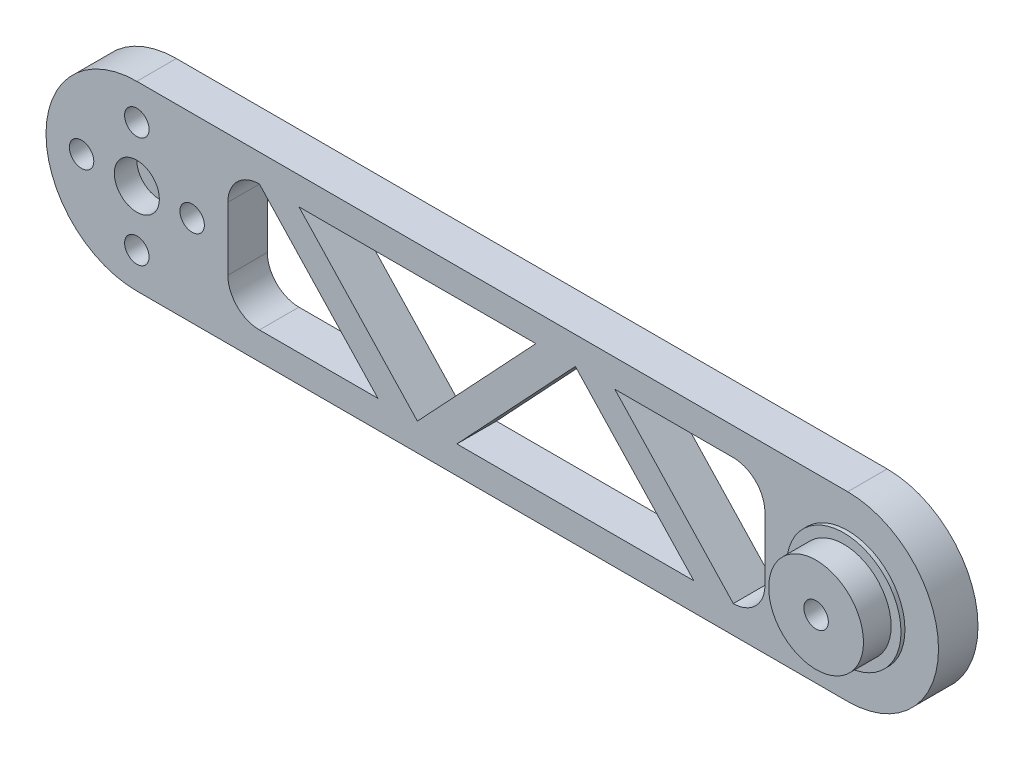
from build123d import *

# Parameters (mm, degrees)
BOSS_EXTRUDE1_DEPTH = 5
SKETCH11_R          = 7.25
BOSS_EXTRUDE3_DEPTH = 0.5
SKETCH12_R          = 6
BOSS_EXTRUDE4_DEPTH = 3.5
SKETCH13_R          = 1.55
CUT_EXTRUDE1_DEPTH  = 20.5
CUT_EXTRUDE2_DEPTH  = 2.6
SKETCH17_R          = 1.55
CUT_EXTRUDE4_DEPTH  = 10.02
SKETCH18_R          = 2.85
CUT_EXTRUDE5_DEPTH  = 2.85
CUT_EXTRUDE7_DEPTH  = 10


with BuildPart() as part:
    # Sketch2 → Boss-Extrude1 (new body)
    with BuildSketch(Plane.XY):
        with BuildLine():
            Line((0, 11.5), (90, 11.5))
            ThreePointArc((90, 11.5), (101.5, 0), (90, -11.5))
            Line((90, -11.5), (0, -11.5))
            ThreePointArc((0, -11.5), (-11.5, 0), (0, 11.5))
        make_face()
    extrude(amount=-BOSS_EXTRUDE1_DEPTH)

    # Sketch11 → Boss-Extrude3 (add)
    with BuildSketch(Plane.XY):
        with Locations((90, 0)):
            Circle(SKETCH11_R)
    extrude(amount=BOSS_EXTRUDE3_DEPTH)

    # Sketch12 → Boss-Extrude4 (add)
    with BuildSketch(Plane.XY.offset(0.5)):
        with Locations((90, 0)):
            Circle(SKETCH12_R)
    extrude(amount=BOSS_EXTRUDE4_DEPTH)

    # Sketch13 → Cut-Extrude1 (cut)
    with BuildSketch(Plane.XY.offset(4)):
        with Locations((90, 0)):
            Circle(SKETCH13_R)
    extrude(amount=-CUT_EXTRUDE1_DEPTH, mode=Mode.SUBTRACT)

    # Sketch14 → Cut-Extrude2 (cut)
    with BuildSketch(Plane(origin=(0, 0, -5), x_dir=(-1, 0, 0), z_dir=(0, 0, -1))):
        Polygon((-93.213605432, -0.355068252), (-91.299304589, -2.960598068), (-88.085699158, -2.605529815), (-86.786394568, 0.355068252), (-88.700695411, 2.960598068), (-91.914300842, 2.605529815), align=None)
    extrude(amount=-CUT_EXTRUDE2_DEPTH, mode=Mode.SUBTRACT)

    # Sketch17 → Cut-Extrude4 (cut)
    with BuildSketch(Plane.XY):
        with Locations((0, 7)):
            Circle(SKETCH17_R)
        with Locations((0, -7)):
            Circle(SKETCH17_R)
        with Locations((-7, 0)):
            Circle(SKETCH17_R)
        with Locations((7, 0)):
            Circle(SKETCH17_R)
    extrude(amount=-CUT_EXTRUDE4_DEPTH, mode=Mode.SUBTRACT)

    # Sketch18 → Cut-Extrude5 (cut)
    with BuildSketch(Plane.XY):
        Circle(SKETCH18_R)
    extrude(amount=-CUT_EXTRUDE5_DEPTH, mode=Mode.SUBTRACT)

    # Sketch19 → Cut-Extrude7 (cut)
    with BuildSketch(Plane.XY):
        with BuildLine():
            Line((30.521520475, -8), (15.521520475, 8))
            ThreePointArc((15.521520475, 8), (12.69309335, 6.828427125), (11.521520475, 4))
            Line((11.521520475, 4), (11.521520475, -4))
            ThreePointArc((11.521520475, -4), (12.69309335, -6.828427125), (15.521520475, -8))
            Line((15.521520475, -8), (30.521520475, -8))
        make_face()
        Polygon((50.521520475, 8), (20.521520475, 8), (35.521520475, -8), align=None)
        Polygon((70.521520475, -8), (55.521520475, 8), (40.521520475, -8), align=None)
        with BuildLine():
            Line((75.521520475, 8), (60.521520475, 8))
            Line((60.521520475, 8), (75.521520475, -8))
            ThreePointArc((75.521520475, -8), (78.3499476, -6.828427125), (79.521520475, -4))
            Line((79.521520475, -4), (79.521520475, 4))
            ThreePointArc((79.521520475, 4), (78.3499476, 6.828427125), (75.521520475, 8))
        make_face()
    extrude(amount=-CUT_EXTRUDE7_DEPTH, mode=Mode.SUBTRACT)


solid = part.part
